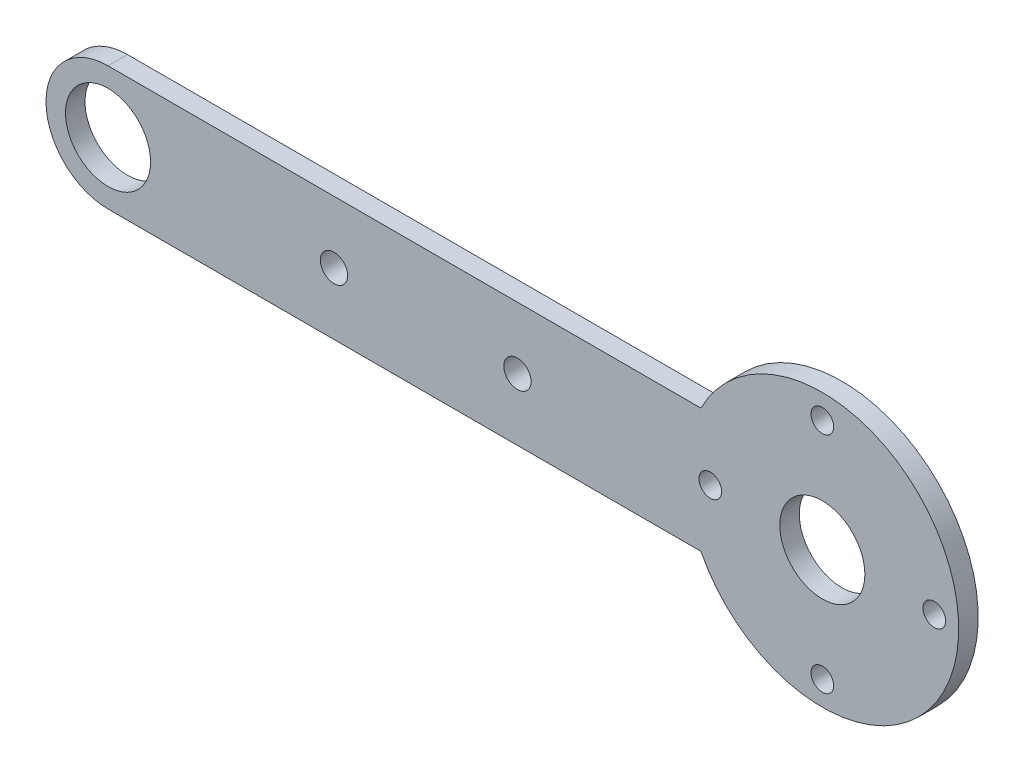
from build123d import *

# Parameters (mm, degrees)
ESQUISSE1_R        = 6.55
ESQUISSE1_R_2      = 2.1
ESQUISSE1_R_3      = 1.75
BOSS_EXTRU_1_DEPTH = 3


with BuildPart() as part:
    # Esquisse1 → Boss.-Extru.1 (new body)
    with BuildSketch(Plane.XY):
        with BuildLine():
            Line((-110, 9.55), (-18.702874111, 9.55))
            ThreePointArc((-18.702874111, 9.55), (21, 0), (-18.702874111, -9.55))
            Line((-18.702874111, -9.55), (-110, -9.55))
            ThreePointArc((-110, -9.55), (-119.55, 0), (-110, 9.55))
        make_face()
        with Locations((-110, 0)):
            Circle(ESQUISSE1_R, mode=Mode.SUBTRACT)
        Circle(ESQUISSE1_R, mode=Mode.SUBTRACT)
        with Locations((-75.200958037, 0)):
            Circle(ESQUISSE1_R_2, mode=Mode.SUBTRACT)
        with Locations((-46.951916074, 0)):
            Circle(ESQUISSE1_R_2, mode=Mode.SUBTRACT)
        with Locations((-17.25, 0)):
            Circle(ESQUISSE1_R_3, mode=Mode.SUBTRACT)
        with Locations((0, 17.25)):
            Circle(ESQUISSE1_R_3, mode=Mode.SUBTRACT)
        with Locations((17.25, 0)):
            Circle(ESQUISSE1_R_3, mode=Mode.SUBTRACT)
        with Locations((0, -17.25)):
            Circle(ESQUISSE1_R_3, mode=Mode.SUBTRACT)
    extrude(amount=BOSS_EXTRU_1_DEPTH)


solid = part.part
